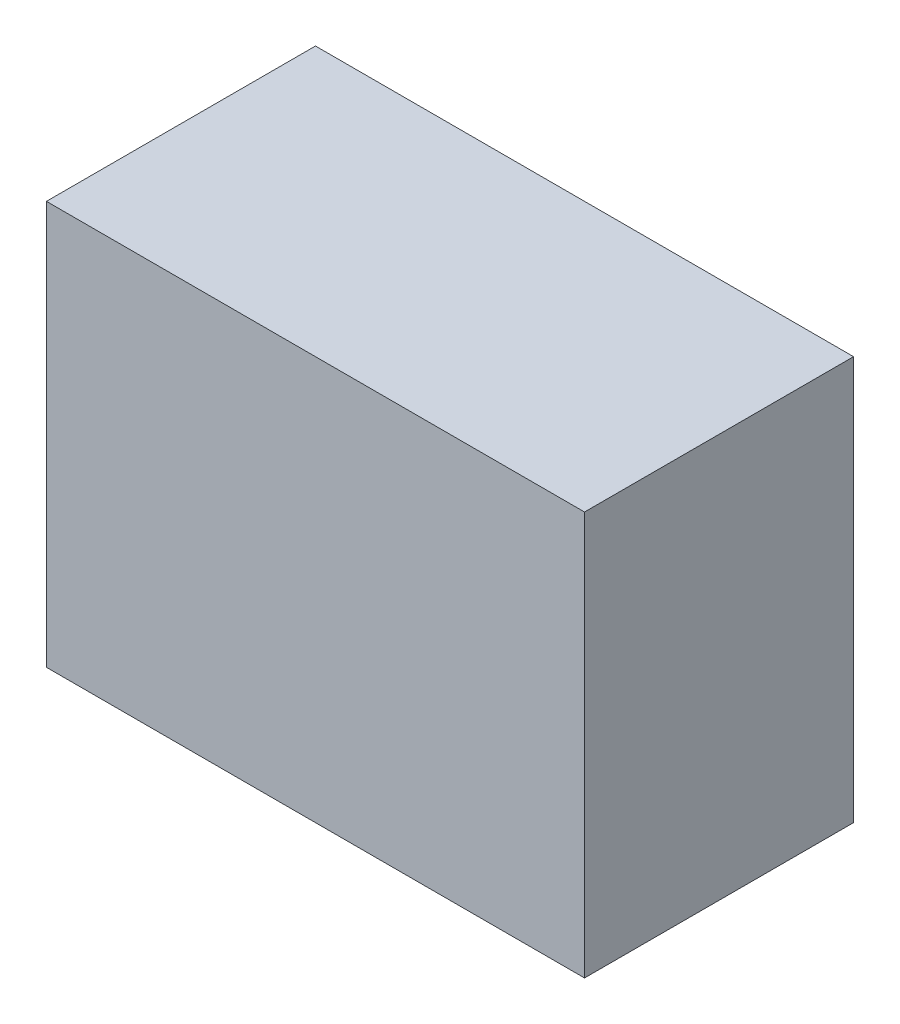
from build123d import *

# Parameters (mm, degrees)
SKETCH1_W           = 8
SKETCH1_H           = 4
BOSS_EXTRUDE1_DEPTH = 6


with BuildPart() as part:
    # Sketch1 → Boss-Extrude1 (new body)
    with BuildSketch(Plane(origin=(0, 0, 0), x_dir=(1, 0, 0), z_dir=(0, 1, 0))):
        Rectangle(SKETCH1_W, SKETCH1_H)
    extrude(amount=BOSS_EXTRUDE1_DEPTH)


solid = part.part
